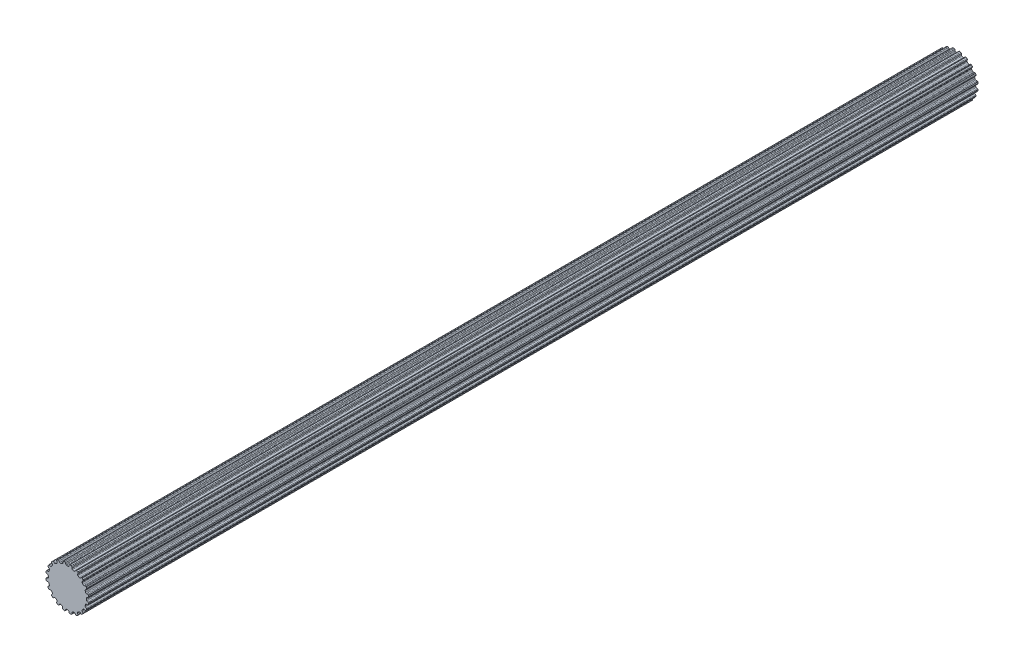
from build123d import *

# Parameters (mm, degrees)
BOSS_EXTRUDE1_DEPTH = 69.469


with BuildPart() as part:
    # Sketch1 → Boss-Extrude1 (new, symmetric)
    with BuildSketch(Plane.XY):
        with BuildLine():
            Line((-0.106949245, 2.969874934), (0.106949245, 2.969874934))
            ThreePointArc((0.106949245, 2.969874934), (0.196343213, 2.986924176), (0.253739238, 3.057547504))
            Line((0.253739238, 3.057547504), (0.315888147, 3.237526941))
            ThreePointArc((0.315888147, 3.237526941), (0.359032156, 3.298322911), (0.4281449, 3.326269005))
            Line((0.4281449, 3.326269005), (0.620027588, 3.2937547))
            ThreePointArc((0.620027588, 3.2937547), (0.689621142, 3.24802576), (0.718272212, 3.169836791))
            Line((0.718272212, 3.169836791), (0.724389167, 2.979527391))
            ThreePointArc((0.724389167, 2.979527391), (0.750934762, 2.9040661), (0.816027049, 2.857568043))
            Line((0.816027049, 2.857568043), (1.019456602, 2.791469774))
            ThreePointArc((1.019456602, 2.791469774), (1.109743823, 2.780060312), (1.186154496, 2.829490741))
            Line((1.186154496, 2.829490741), (1.300878326, 2.981456288))
            ThreePointArc((1.300878326, 2.981456288), (1.360697704, 3.02594446), (1.435063648, 3.031165762))
            Line((1.435063648, 3.031165762), (1.607507455, 2.940947809))
            ThreePointArc((1.607507455, 2.940947809), (1.659563839, 2.875951412), (1.662650905, 2.792735615))
            Line((1.662650905, 2.792735615), (1.609659636, 2.609850378))
            ThreePointArc((1.609659636, 2.609850378), (1.611587176, 2.529879385), (1.659124931, 2.465542482))
            Line((1.659124931, 2.465542482), (1.832172444, 2.339816104))
            ThreePointArc((1.832172444, 2.339816104), (1.914514976, 2.301064775), (2.002460687, 2.32446371))
            Line((2.002460687, 2.32446371), (2.158529469, 2.433539921))
            ThreePointArc((2.158529469, 2.433539921), (2.229168681, 2.457365482), (2.301508367, 2.439350895))
            Line((2.301508367, 2.439350895), (2.437633293, 2.300260456))
            ThreePointArc((2.437633293, 2.300260456), (2.467056864, 2.222358901), (2.444277744, 2.14226202))
            Line((2.444277744, 2.14226202), (2.337365406, 1.984703026))
            ThreePointArc((2.337365406, 1.984703026), (2.314486209, 1.908050449), (2.339816104, 1.832172444))
            Line((2.339816104, 1.832172444), (2.465542482, 1.659124931))
            ThreePointArc((2.465542482, 1.659124931), (2.531880064, 1.596824985), (2.622752074, 1.591901975))
            Line((2.622752074, 1.591901975), (2.804888709, 1.64741171))
            ThreePointArc((2.804888709, 1.64741171), (2.879433095, 1.648242449), (2.942665411, 1.608755366))
            Line((2.942665411, 1.608755366), (3.0291466, 1.434407582))
            ThreePointArc((3.0291466, 1.434407582), (3.033057175, 1.351226417), (2.986641646, 1.282088892))
            Line((2.986641646, 1.282088892), (2.836273564, 1.165279113))
            ThreePointArc((2.836273564, 1.165279113), (2.790827206, 1.099448241), (2.791469774, 1.019456602))
            Line((2.791469774, 1.019456602), (2.857568043, 0.816027049))
            ThreePointArc((2.857568043, 0.816027049), (2.901407091, 0.736276839), (2.986310214, 0.703513784))
            Line((2.986310214, 0.703513784), (3.1766859, 0.700023363))
            ThreePointArc((3.1766859, 0.700023363), (3.247838536, 0.677777961), (3.295773863, 0.620683653))
            Line((3.295773863, 0.620683653), (3.324145932, 0.4281449))
            ThreePointArc((3.324145932, 0.4281449), (3.302160717, 0.347826477), (3.236652255, 0.29641597))
            Line((3.236652255, 0.29641597), (3.057547504, 0.231789562))
            ThreePointArc((3.057547504, 0.231789562), (2.993982591, 0.183224379), (2.969874934, 0.106949245))
            Line((2.969874934, 0.106949245), (2.969874934, -0.106949245))
            ThreePointArc((2.969874934, -0.106949245), (2.986924176, -0.196343213), (3.057547504, -0.253739238))
            Line((3.057547504, -0.253739238), (3.237526941, -0.315888147))
            ThreePointArc((3.237526941, -0.315888147), (3.298322911, -0.359032156), (3.326269005, -0.4281449))
            Line((3.326269005, -0.4281449), (3.2937547, -0.620027588))
            ThreePointArc((3.2937547, -0.620027588), (3.24802576, -0.689621142), (3.169836791, -0.718272212))
            Line((3.169836791, -0.718272212), (2.979527391, -0.724389167))
            ThreePointArc((2.979527391, -0.724389167), (2.9040661, -0.750934762), (2.857568043, -0.816027049))
            Line((2.857568043, -0.816027049), (2.791469774, -1.019456602))
            ThreePointArc((2.791469774, -1.019456602), (2.780060312, -1.109743823), (2.829490741, -1.186154496))
            Line((2.829490741, -1.186154496), (2.981456288, -1.300878326))
            ThreePointArc((2.981456288, -1.300878326), (3.02594446, -1.360697704), (3.031165762, -1.435063648))
            Line((3.031165762, -1.435063648), (2.940947809, -1.607507455))
            ThreePointArc((2.940947809, -1.607507455), (2.875951412, -1.659563839), (2.792735615, -1.662650905))
            Line((2.792735615, -1.662650905), (2.609850378, -1.609659636))
            ThreePointArc((2.609850378, -1.609659636), (2.529879385, -1.611587176), (2.465542482, -1.659124931))
            Line((2.465542482, -1.659124931), (2.339816104, -1.832172444))
            ThreePointArc((2.339816104, -1.832172444), (2.301064775, -1.914514976), (2.32446371, -2.002460687))
            Line((2.32446371, -2.002460687), (2.433539921, -2.158529469))
            ThreePointArc((2.433539921, -2.158529469), (2.457365482, -2.229168681), (2.439350895, -2.301508367))
            Line((2.439350895, -2.301508367), (2.300260456, -2.437633293))
            ThreePointArc((2.300260456, -2.437633293), (2.222358901, -2.467056864), (2.14226202, -2.444277744))
            Line((2.14226202, -2.444277744), (1.984703026, -2.337365406))
            ThreePointArc((1.984703026, -2.337365406), (1.908050449, -2.314486209), (1.832172444, -2.339816104))
            Line((1.832172444, -2.339816104), (1.659124931, -2.465542482))
            ThreePointArc((1.659124931, -2.465542482), (1.596824985, -2.531880064), (1.591901975, -2.622752074))
            Line((1.591901975, -2.622752074), (1.64741171, -2.804888709))
            ThreePointArc((1.64741171, -2.804888709), (1.648242449, -2.879433095), (1.608755366, -2.942665411))
            Line((1.608755366, -2.942665411), (1.434407582, -3.0291466))
            ThreePointArc((1.434407582, -3.0291466), (1.351226417, -3.033057175), (1.282088892, -2.986641646))
            Line((1.282088892, -2.986641646), (1.165279113, -2.836273564))
            ThreePointArc((1.165279113, -2.836273564), (1.099448241, -2.790827206), (1.019456602, -2.791469774))
            Line((1.019456602, -2.791469774), (0.816027049, -2.857568043))
            ThreePointArc((0.816027049, -2.857568043), (0.736276839, -2.901407091), (0.703513784, -2.986310214))
            Line((0.703513784, -2.986310214), (0.700023363, -3.1766859))
            ThreePointArc((0.700023363, -3.1766859), (0.677777961, -3.247838536), (0.620683653, -3.295773863))
            Line((0.620683653, -3.295773863), (0.4281449, -3.324145932))
            ThreePointArc((0.4281449, -3.324145932), (0.347826477, -3.302160717), (0.29641597, -3.236652255))
            Line((0.29641597, -3.236652255), (0.231789562, -3.057547504))
            ThreePointArc((0.231789562, -3.057547504), (0.183224379, -2.993982591), (0.106949245, -2.969874934))
            Line((0.106949245, -2.969874934), (-0.106949245, -2.969874934))
            ThreePointArc((-0.106949245, -2.969874934), (-0.196343213, -2.986924176), (-0.253739238, -3.057547504))
            Line((-0.253739238, -3.057547504), (-0.315888147, -3.237526941))
            ThreePointArc((-0.315888147, -3.237526941), (-0.359032156, -3.298322911), (-0.4281449, -3.326269005))
            Line((-0.4281449, -3.326269005), (-0.620027588, -3.2937547))
            ThreePointArc((-0.620027588, -3.2937547), (-0.689621142, -3.24802576), (-0.718272212, -3.169836791))
            Line((-0.718272212, -3.169836791), (-0.724389167, -2.979527391))
            ThreePointArc((-0.724389167, -2.979527391), (-0.750934762, -2.9040661), (-0.816027049, -2.857568043))
            Line((-0.816027049, -2.857568043), (-1.019456602, -2.791469774))
            ThreePointArc((-1.019456602, -2.791469774), (-1.109743823, -2.780060312), (-1.186154496, -2.829490741))
            Line((-1.186154496, -2.829490741), (-1.300878326, -2.981456288))
            ThreePointArc((-1.300878326, -2.981456288), (-1.360697704, -3.02594446), (-1.435063648, -3.031165762))
            Line((-1.435063648, -3.031165762), (-1.607507455, -2.940947809))
            ThreePointArc((-1.607507455, -2.940947809), (-1.659563839, -2.875951412), (-1.662650905, -2.792735615))
            Line((-1.662650905, -2.792735615), (-1.609659636, -2.609850378))
            ThreePointArc((-1.609659636, -2.609850378), (-1.611587176, -2.529879385), (-1.659124931, -2.465542482))
            Line((-1.659124931, -2.465542482), (-1.832172444, -2.339816104))
            ThreePointArc((-1.832172444, -2.339816104), (-1.914514976, -2.301064775), (-2.002460687, -2.32446371))
            Line((-2.002460687, -2.32446371), (-2.158529469, -2.433539921))
            ThreePointArc((-2.158529469, -2.433539921), (-2.229168681, -2.457365482), (-2.301508367, -2.439350895))
            Line((-2.301508367, -2.439350895), (-2.437633293, -2.300260456))
            ThreePointArc((-2.437633293, -2.300260456), (-2.467056864, -2.222358901), (-2.444277744, -2.14226202))
            Line((-2.444277744, -2.14226202), (-2.337365406, -1.984703026))
            ThreePointArc((-2.337365406, -1.984703026), (-2.314486209, -1.908050449), (-2.339816104, -1.832172444))
            Line((-2.339816104, -1.832172444), (-2.465542482, -1.659124931))
            ThreePointArc((-2.465542482, -1.659124931), (-2.531880064, -1.596824985), (-2.622752074, -1.591901975))
            Line((-2.622752074, -1.591901975), (-2.804888709, -1.64741171))
            ThreePointArc((-2.804888709, -1.64741171), (-2.879433095, -1.648242449), (-2.942665411, -1.608755366))
            Line((-2.942665411, -1.608755366), (-3.0291466, -1.434407582))
            ThreePointArc((-3.0291466, -1.434407582), (-3.033057175, -1.351226417), (-2.986641646, -1.282088892))
            Line((-2.986641646, -1.282088892), (-2.836273564, -1.165279113))
            ThreePointArc((-2.836273564, -1.165279113), (-2.790827206, -1.099448241), (-2.791469774, -1.019456602))
            Line((-2.791469774, -1.019456602), (-2.857568043, -0.816027049))
            ThreePointArc((-2.857568043, -0.816027049), (-2.901407091, -0.736276839), (-2.986310214, -0.703513784))
            Line((-2.986310214, -0.703513784), (-3.1766859, -0.700023363))
            ThreePointArc((-3.1766859, -0.700023363), (-3.247838536, -0.677777961), (-3.295773863, -0.620683653))
            Line((-3.295773863, -0.620683653), (-3.324145932, -0.4281449))
            ThreePointArc((-3.324145932, -0.4281449), (-3.302160717, -0.347826477), (-3.236652255, -0.29641597))
            Line((-3.236652255, -0.29641597), (-3.057547504, -0.231789562))
            ThreePointArc((-3.057547504, -0.231789562), (-2.993982591, -0.183224379), (-2.969874934, -0.106949245))
            Line((-2.969874934, -0.106949245), (-2.969874934, 0.106949245))
            ThreePointArc((-2.969874934, 0.106949245), (-2.986924176, 0.196343213), (-3.057547504, 0.253739238))
            Line((-3.057547504, 0.253739238), (-3.237526941, 0.315888147))
            ThreePointArc((-3.237526941, 0.315888147), (-3.298322911, 0.359032156), (-3.326269005, 0.4281449))
            Line((-3.326269005, 0.4281449), (-3.2937547, 0.620027588))
            ThreePointArc((-3.2937547, 0.620027588), (-3.24802576, 0.689621142), (-3.169836791, 0.718272212))
            Line((-3.169836791, 0.718272212), (-2.979527391, 0.724389167))
            ThreePointArc((-2.979527391, 0.724389167), (-2.9040661, 0.750934762), (-2.857568043, 0.816027049))
            Line((-2.857568043, 0.816027049), (-2.791469774, 1.019456602))
            ThreePointArc((-2.791469774, 1.019456602), (-2.780060312, 1.109743823), (-2.829490741, 1.186154496))
            Line((-2.829490741, 1.186154496), (-2.981456288, 1.300878326))
            ThreePointArc((-2.981456288, 1.300878326), (-3.02594446, 1.360697704), (-3.031165762, 1.435063648))
            Line((-3.031165762, 1.435063648), (-2.940947809, 1.607507455))
            ThreePointArc((-2.940947809, 1.607507455), (-2.875951412, 1.659563839), (-2.792735615, 1.662650905))
            Line((-2.792735615, 1.662650905), (-2.609850378, 1.609659636))
            ThreePointArc((-2.609850378, 1.609659636), (-2.529879385, 1.611587176), (-2.465542482, 1.659124931))
            Line((-2.465542482, 1.659124931), (-2.339816104, 1.832172444))
            ThreePointArc((-2.339816104, 1.832172444), (-2.301064775, 1.914514976), (-2.32446371, 2.002460687))
            Line((-2.32446371, 2.002460687), (-2.433539921, 2.158529469))
            ThreePointArc((-2.433539921, 2.158529469), (-2.457365482, 2.229168681), (-2.439350895, 2.301508367))
            Line((-2.439350895, 2.301508367), (-2.300260456, 2.437633293))
            ThreePointArc((-2.300260456, 2.437633293), (-2.222358901, 2.467056864), (-2.14226202, 2.444277744))
            Line((-2.14226202, 2.444277744), (-1.984703026, 2.337365406))
            ThreePointArc((-1.984703026, 2.337365406), (-1.908050449, 2.314486209), (-1.832172444, 2.339816104))
            Line((-1.832172444, 2.339816104), (-1.659124931, 2.465542482))
            ThreePointArc((-1.659124931, 2.465542482), (-1.596824985, 2.531880064), (-1.591901975, 2.622752074))
            Line((-1.591901975, 2.622752074), (-1.64741171, 2.804888709))
            ThreePointArc((-1.64741171, 2.804888709), (-1.648242449, 2.879433095), (-1.608755366, 2.942665411))
            Line((-1.608755366, 2.942665411), (-1.434407582, 3.0291466))
            ThreePointArc((-1.434407582, 3.0291466), (-1.351226417, 3.033057175), (-1.282088892, 2.986641646))
            Line((-1.282088892, 2.986641646), (-1.165279113, 2.836273564))
            ThreePointArc((-1.165279113, 2.836273564), (-1.099448241, 2.790827206), (-1.019456602, 2.791469774))
            Line((-1.019456602, 2.791469774), (-0.816027049, 2.857568043))
            ThreePointArc((-0.816027049, 2.857568043), (-0.736276839, 2.901407091), (-0.703513784, 2.986310214))
            Line((-0.703513784, 2.986310214), (-0.700023363, 3.1766859))
            ThreePointArc((-0.700023363, 3.1766859), (-0.677777961, 3.247838536), (-0.620683653, 3.295773863))
            Line((-0.620683653, 3.295773863), (-0.4281449, 3.324145932))
            ThreePointArc((-0.4281449, 3.324145932), (-0.347826477, 3.302160717), (-0.29641597, 3.236652255))
            Line((-0.29641597, 3.236652255), (-0.231789562, 3.057547504))
            ThreePointArc((-0.231789562, 3.057547504), (-0.183224379, 2.993982591), (-0.106949245, 2.969874934))
        make_face()
    extrude(amount=BOSS_EXTRUDE1_DEPTH, both=True)


solid = part.part
